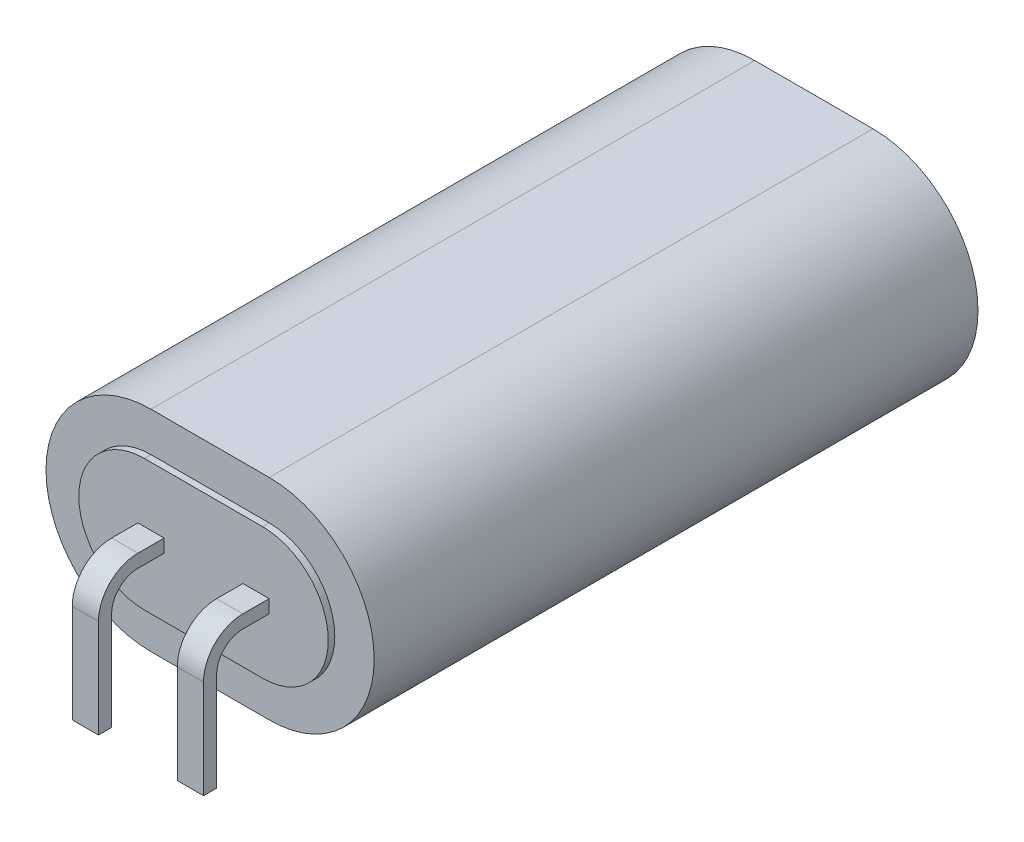
from build123d import *

# Parameters (mm, degrees)
EXTRUDE1_DEPTH          = 23
EXTRUDE2_DEPTH          = 23.5
SKETCH6_W               = 2
SKETCH6_H               = 1
MIRROR2_COPY_1_SKETCH_W = 2
MIRROR2_COPY_1_SKETCH_H = 1


with BuildPart() as part:
    # Sketch1 → Extrude1 (new, symmetric)
    with BuildSketch(Plane.XY):
        with BuildLine():
            Line((-4.5, 8), (4.5, 8))
            ThreePointArc((4.5, 8), (12.5, 0), (4.5, -8))
            Line((4.5, -8), (-4.5, -8))
            ThreePointArc((-4.5, -8), (-12.5, 0), (-4.5, 8))
        make_face()
    extrude(amount=EXTRUDE1_DEPTH, both=True)

    # Sketch2 → Extrude2 (add, symmetric)
    with BuildSketch(Plane.XY):
        with BuildLine():
            Line((-4.5, -5), (4.5, -5))
            ThreePointArc((4.5, -5), (9.5, 0), (4.5, 5))
            Line((4.5, 5), (-4.5, 5))
            ThreePointArc((-4.5, 5), (-9.5, 0), (-4.5, -5))
        make_face()
    extrude(amount=EXTRUDE2_DEPTH, both=True)

    # Sweep1: sweep along a path in Sketch3
    with BuildLine(Plane(origin=(-4, 0, 0), x_dir=(0, 0, -1), z_dir=(1, 0, 0))) as sweep1_path:
        Line((0, 0), (-25.5, 0))
        ThreePointArc((-25.5, 0), (-27.267766953, -0.732233047), (-28, -2.5))
        Line((-28, -2.5), (-28, -10))
    # Sketch6 → Sweep1 (sweep)
    with BuildSketch(Plane.XY):
        with Locations((-4, 0)):
            Rectangle(SKETCH6_W, SKETCH6_H)
    sweep1 = sweep(path=sweep1_path.line)

    # Mirror1: Sweep1 across plane
    add(sweep1.mirror(Plane(origin=(0, 0, 0), x_dir=(0, 0, 1), z_dir=(1, 0, 0))))

    # Mirror2: Sweep1 across plane
    add(sweep1.mirror(Plane.XY))

    # Mirror2 copy 1: sweep along a path in Mirror2 copy 1 path
    with BuildLine(Plane.ZY.offset(-4)) as mirror2_copy_1_path:
        Line((0, 0), (-25.5, 0))
        ThreePointArc((-25.5, 0), (-27.267766953, -0.732233047), (-28, -2.5))
        Line((-28, -2.5), (-28, -10))
    # Mirror2 copy 1 sketch → Mirror2 copy 1 (sweep)
    with BuildSketch(Plane(origin=(0, 0, 0), x_dir=(-1, 0, 0), z_dir=(0, 0, -1))):
        with Locations((-4, 0)):
            Rectangle(MIRROR2_COPY_1_SKETCH_W, MIRROR2_COPY_1_SKETCH_H)
    sweep(path=mirror2_copy_1_path.line)


solid = part.part
